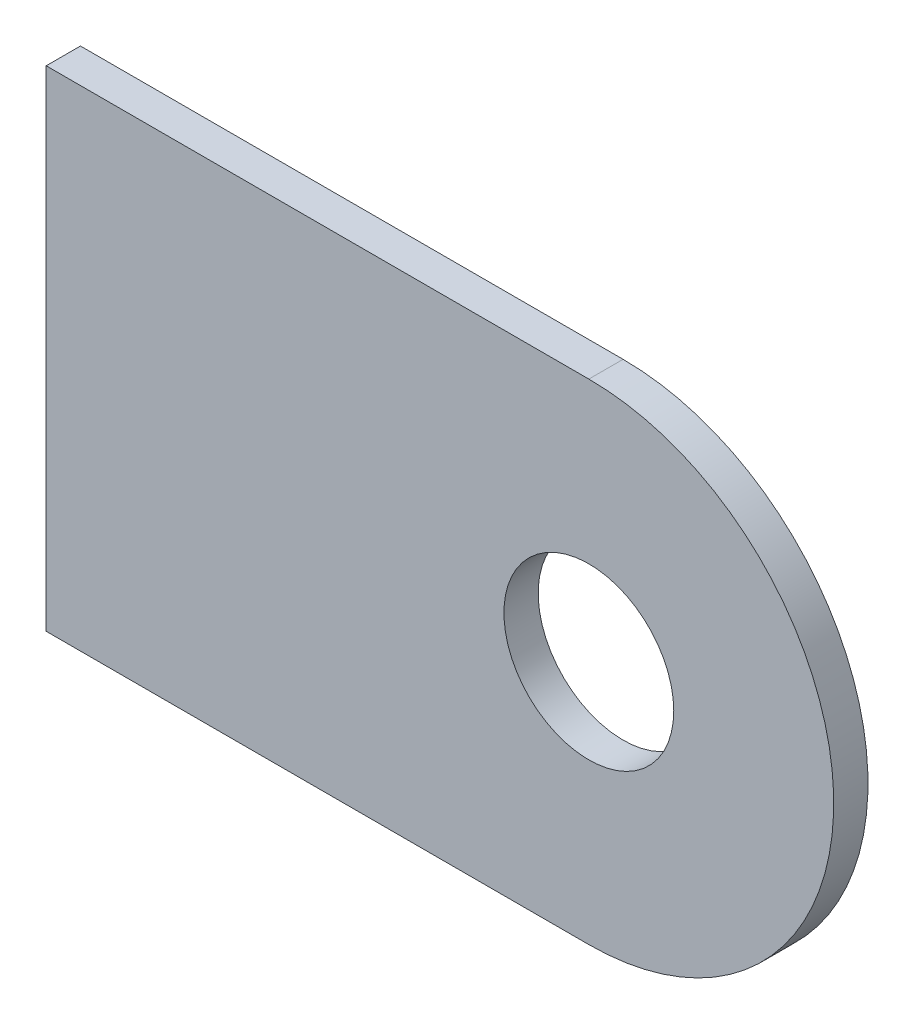
from build123d import *

# Parameters (mm, degrees)
SKETCH2_R           = 3.937
BOSS_EXTRUDE1_DEPTH = 1.5875


with BuildPart() as part:
    # Sketch2 → Boss-Extrude1 (new body)
    with BuildSketch(Plane.XY):
        with BuildLine():
            Line((0, 0), (25.1587, 0))
            ThreePointArc((25.1587, 0), (36.5125, 11.3538), (25.1587, 22.7076))
            Line((25.1587, 22.7076), (0, 22.7076))
            Line((0, 22.7076), (0, 0))
        make_face()
        with Locations((25.1587, 11.3538)):
            Circle(SKETCH2_R, mode=Mode.SUBTRACT)
    extrude(amount=BOSS_EXTRUDE1_DEPTH)


solid = part.part
